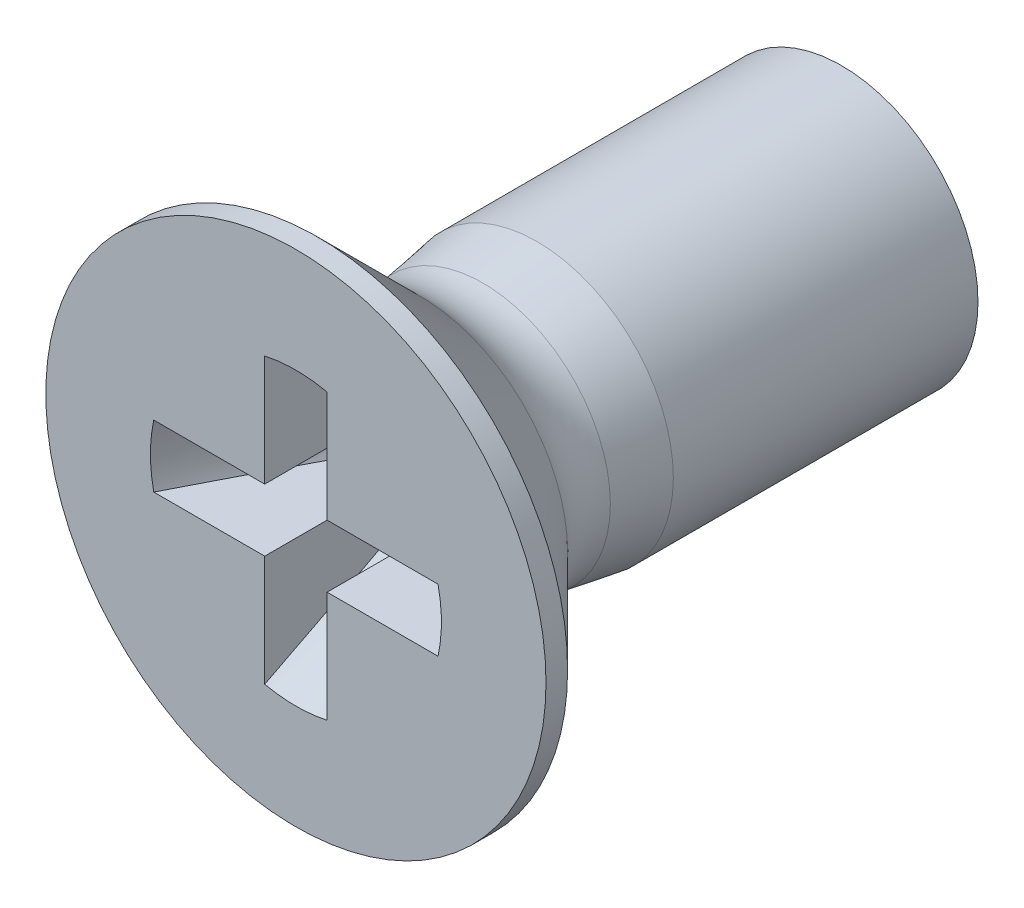
from build123d import *

# Parameters (mm, degrees)
CROSS_DEPTH       = 3.2
CIRPATTERN1_COUNT = 4
FILLET1_R         = 0.8


with BuildPart() as part:
    # Sketch1 → RevolveBase (revolve)
    with BuildSketch(Plane(origin=(0, 0, 0), x_dir=(0, 0, -1), z_dir=(1, 0, 0)), mode=Mode.PRIVATE) as revolvebase_sk:
        Polygon((0, 0), (0, 2.75), (0.2375, 2.75), (1.65, 1.3375), (1.65, 1.65), (6, 1.65), (6, 0), align=None)
    revolve(revolvebase_sk.sketch.rotate(Axis((0, 0, 0), (0, 0, -1)), 90), axis=Axis((0, 0, 0), (0, 0, -1)))

    # Sketch3 → Cross (cut)
    with BuildSketch(Plane.XY):
        with BuildLine():
            Line((-0.342946789, 0), (0.342946789, 0))
            Line((0.342946789, 0), (0.342946789, 1.562813968))
            ThreePointArc((0.342946789, 1.562813968), (0, 1.6), (-0.342946789, 1.562813968))
            Line((-0.342946789, 1.562813968), (-0.342946789, 0))
        make_face()
    cross = extrude(amount=-CROSS_DEPTH, mode=Mode.SUBTRACT)

    # CirPattern1: Cross ×4 about axis
    cirpattern1_axis = Axis((0, 0, 0), (0, 0, 1))
    for i in range(1, CIRPATTERN1_COUNT):
        add(cross.rotate(cirpattern1_axis, i * 360 / CIRPATTERN1_COUNT), mode=Mode.SUBTRACT)

    # Sketch5 → RevolveRod (revolve)
    with BuildSketch(Plane(origin=(0, 0, 0), x_dir=(0, 0, -1), z_dir=(1, 0, 0)), mode=Mode.PRIVATE) as revolverod_sk:
        Polygon((0, 2.102030651), (0, 1.6), (1.935490568, 0.635), (2.273126058, 0), (6, 0), (6, 1.5), (1.65, 1.5), (1.65, 1.3375), (0.885469349, 2.102030651), align=None)
    revolve(revolverod_sk.sketch.rotate(Axis((0, 0, 0), (0, 0, -1)), 90), axis=Axis((0, 0, 0), (0, 0, -1)))

    # Sketch7 → CutBody (revolve, cut)
    with BuildSketch(Plane(origin=(0, 0, 0), x_dir=(0, 0, -1), z_dir=(1, 0, 0)), mode=Mode.PRIVATE) as cutbody_sk:
        Polygon((1.65, 3.5), (1.65, 1.3375), (2.65, 1.5), (6, 1.5), (6, 3.5), align=None)
    revolve(cutbody_sk.sketch.rotate(Axis((0, 0, 0), (0, 0, -1)), 90), axis=Axis((0, 0, 0), (0, 0, -1)), mode=Mode.SUBTRACT)

    # Fillet1
    fillet1_edges = [part.edges().sort_by_distance(p)[0] for p in [
        (1.326274207, -0.172924772, -1.65),
    ]]
    fillet(fillet1_edges, radius=FILLET1_R)


solid = part.part
